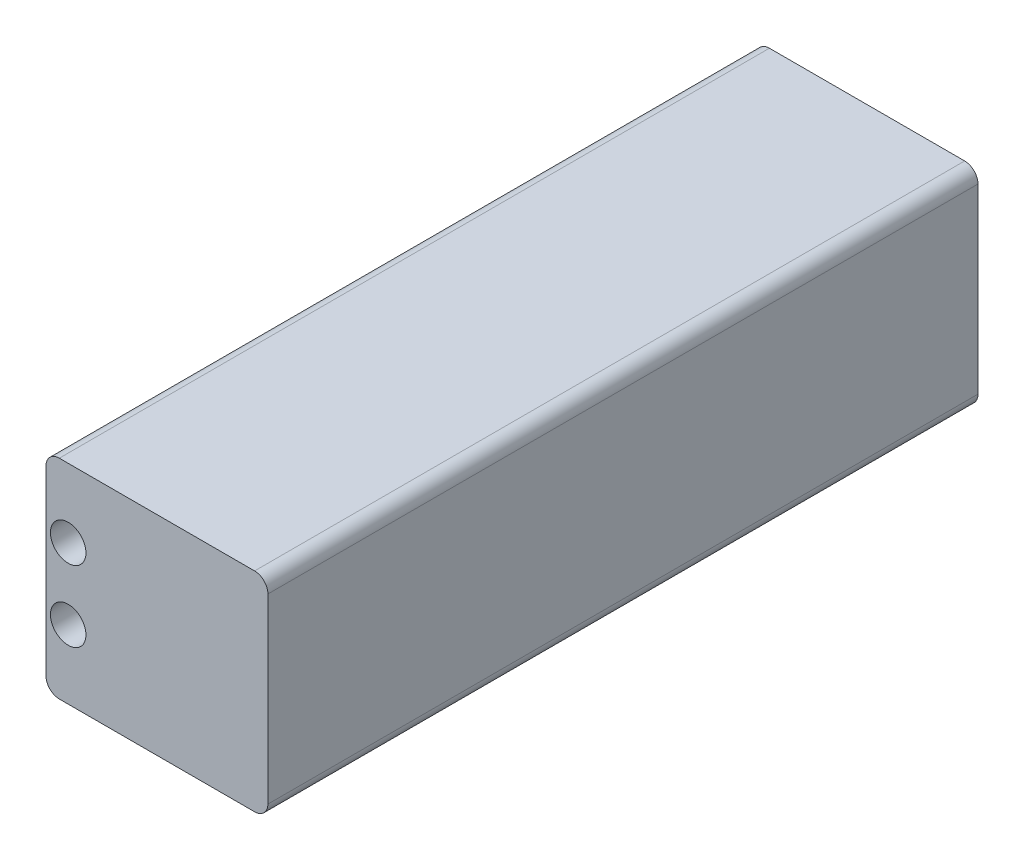
from build123d import *

# Parameters (mm, degrees)
SKETCH1_W           = 50
SKETCH1_H           = 160
BOSS_EXTRUDE1_DEPTH = 47
SKETCH2_R           = 4
CUT_EXTRUDE1_DEPTH  = 10
FILLET1_R           = 3


with BuildPart() as part:
    # Sketch1 → Boss-Extrude1 (new body)
    with BuildSketch(Plane(origin=(0, 0, 0), x_dir=(1, 0, 0), z_dir=(0, 1, 0))):
        Rectangle(SKETCH1_W, SKETCH1_H)
    extrude(amount=BOSS_EXTRUDE1_DEPTH)

    # Sketch2 → Cut-Extrude1 (cut)
    with BuildSketch(Plane.XY.offset(80)):
        with Locations((-20, 31.5)):
            Circle(SKETCH2_R)
        with Locations(Location((-20, 15.5, 0), (0, 0, 180))):
            Circle(SKETCH2_R)
    extrude(amount=-CUT_EXTRUDE1_DEPTH, mode=Mode.SUBTRACT)

    # Fillet1
    fillet1_edges = [part.edges().sort_by_distance(p)[0] for p in [
        (-25, 47, 0),
        (25, 47, 0),
        (-25, 0, 0),
        (25, 0, 0),
    ]]
    fillet(fillet1_edges, radius=FILLET1_R)


solid = part.part
